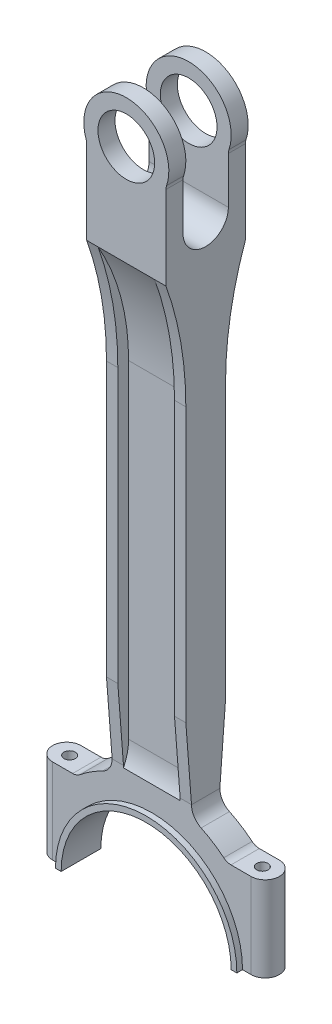
from build123d import *

# Parameters (mm, degrees)
SKETCH1_R               = 5
BOSS_EXTRUDE1_DEPTH     = 14
CUT_EXTRUDE1_DEPTH      = 14
CUT_EXTRUDE1_DEPTH_BACK = 21
CUT_EXTRUDE2_DEPTH      = 26
CUT_EXTRUDE2_DEPTH_BACK = 28
CUT_EXTRUDE3_DEPTH      = 5
CUT_EXTRUDE3_DEPTH_BACK = 5
CUT_EXTRUDE4_START      = -1
CUT_EXTRUDE4_DEPTH      = 1
CUT_EXTRUDE6_START      = -7
CUT_EXTRUDE6_DEPTH      = 1
SKETCH8_R               = 1
CUT_EXTRUDE8_DEPTH      = 15
FILLET2_RADIUS          = 2.5
FILLET2_LENGTH          = 15
FILLET3_RADIUS          = 2.5
FILLET3_LENGTH          = 15
FILLET4_R               = 3
FILLET5_R               = 2
CUT_EXTRUDE9_DEPTH      = 95.601560752
CUT_EXTRUDE9_DEPTH_BACK = 22
CUT_EXTRUDE10_DEPTH     = 19


with BuildPart() as part:
    # Sketch1 → Boss-Extrude1 (new body)
    with BuildSketch(Plane.XY):
        with BuildLine():
            Line((7, 27.728093549), (7, -70.844330052))
            ThreePointArc((7, -70.844330052), (9.983048869, -72.249040285), (12.694763676, -74.124778593))
            ThreePointArc((12.694763676, -74.124778593), (13.290040181, -74.462261791), (13.964240044, -74.579324047))
            Line((13.964240044, -74.579324047), (20, -74.579324047))
            Line((20, -74.579324047), (20, -89.579324047))
            Line((20, -89.579324047), (15, -89.579324047))
            ThreePointArc((15, -89.579324047), (0, -74.579324047), (-15, -89.579324047))
            Line((-15, -89.579324047), (-20, -89.579324047))
            Line((-20, -89.579324047), (-20, -74.579324047))
            Line((-20, -74.579324047), (-13.964240044, -74.579324047))
            ThreePointArc((-13.964240044, -74.579324047), (-13.290040181, -74.462261791), (-12.694763676, -74.124778593))
            ThreePointArc((-12.694763676, -74.124778593), (-9.983048869, -72.249040285), (-7, -70.844330052))
            Line((-7, -70.844330052), (-7, 27.728093549))
            ThreePointArc((-7, 27.728093549), (0, 37.920675953), (7, 27.728093549))
        make_face()
        with Locations((0, 30.420675953)):
            Circle(SKETCH1_R, mode=Mode.SUBTRACT)
    extrude(amount=BOSS_EXTRUDE1_DEPTH)

    # Sketch2 → Cut-Extrude1 (cut, two sides: drawn at the far end of the back side and taken through both)
    with BuildSketch(Plane(origin=(7, 0, 0), x_dir=(0, 0, -1), z_dir=(1, 0, 0)).offset(-CUT_EXTRUDE1_DEPTH_BACK)):
        with BuildLine():
            Line((-11, 19.155669948), (-11, 94.026923789))
            Line((-11, 94.026923789), (-3, 94.026923789))
            Line((-3, 94.026923789), (-3, 19.155669948))
            ThreePointArc((-3, 19.155669948), (-7, 15.155669948), (-11, 19.155669948))
        make_face()
    extrude(amount=CUT_EXTRUDE1_DEPTH + CUT_EXTRUDE1_DEPTH_BACK, mode=Mode.SUBTRACT)

    # Sketch3 → Cut-Extrude2 (cut, two sides: drawn at the far end of the back side and taken through both)
    with BuildSketch(Plane.ZY.offset(7).offset(-CUT_EXTRUDE2_DEPTH_BACK)):
        with BuildLine():
            Line((3.5, -7.579324047), (3.5, -89.579324047))
            Line((3.5, -89.579324047), (0, -89.579324047))
            Line((0, -89.579324047), (0, 12.613496459))
            ThreePointArc((0, 12.613496459), (2.618525015, 2.667626719), (3.5, -7.579324047))
        make_face()
        with BuildLine():
            Line((10.5, -7.579324047), (10.5, -89.579324047))
            Line((10.5, -89.579324047), (14, -89.579324047))
            Line((14, -89.579324047), (14, 12.613496459))
            ThreePointArc((14, 12.613496459), (11.381474985, 2.667626719), (10.5, -7.579324047))
        make_face()
    extrude(amount=CUT_EXTRUDE2_DEPTH + CUT_EXTRUDE2_DEPTH_BACK, mode=Mode.SUBTRACT)

    # Sketch4 → Cut-Extrude3 (cut, two sides: drawn at the far end of the back side and taken through both)
    with BuildSketch(Plane(origin=(0, 0, 0), x_dir=(0, 0, -1), z_dir=(1, 0, 0)).offset(-CUT_EXTRUDE3_DEPTH_BACK)):
        with BuildLine():
            Line((-5.4, -7.457377961), (-5.4, -65.313507329))
            ThreePointArc((-5.4, -65.313507329), (-4.911756575, -68.237545632), (-3.5, -70.844330052))
            Line((-3.5, -70.844330052), (19.637557059, -70.844330052))
            Line((19.637557059, -70.844330052), (19.637557059, 12.613496459))
            Line((19.637557059, 12.613496459), (0, 12.613496459))
            ThreePointArc((0, 12.613496459), (-4.026415832, 2.934926884), (-5.4, -7.457377961))
        make_face()
        with BuildLine():
            Line((-8.6, -7.457377961), (-8.6, -65.313507329))
            ThreePointArc((-8.6, -65.313507329), (-9.088243425, -68.237545632), (-10.5, -70.844330052))
            Line((-10.5, -70.844330052), (-24.530573049, -70.844330052))
            Line((-24.530573049, -70.844330052), (-24.530573049, 12.613496459))
            Line((-24.530573049, 12.613496459), (-14, 12.613496459))
            ThreePointArc((-14, 12.613496459), (-9.973584168, 2.934926884), (-8.6, -7.457377961))
        make_face()
    extrude(amount=CUT_EXTRUDE3_DEPTH + CUT_EXTRUDE3_DEPTH_BACK, mode=Mode.SUBTRACT)

    # Sketch5 → Cut-Extrude4 (cut)
    with BuildSketch(Plane.XY.offset(10.5).offset(CUT_EXTRUDE4_START)):
        with BuildLine():
            Line((-16, -89.579324047), (-20, -89.579324047))
            Line((-20, -89.579324047), (-20, -74.579324047))
            Line((-20, -74.579324047), (-13.964240044, -74.579324047))
            ThreePointArc((-13.964240044, -74.579324047), (-13.290040181, -74.462261791), (-12.694763676, -74.124778593))
            ThreePointArc((-12.694763676, -74.124778593), (0, -69.579324047), (12.694763676, -74.124778593))
            ThreePointArc((12.694763676, -74.124778593), (13.290040181, -74.462261791), (13.964240044, -74.579324047))
            Line((13.964240044, -74.579324047), (20, -74.579324047))
            Line((20, -74.579324047), (20, -89.579324047))
            Line((20, -89.579324047), (16, -89.579324047))
            ThreePointArc((16, -89.579324047), (0, -73.579324047), (-16, -89.579324047))
        make_face()
    extrude(amount=CUT_EXTRUDE4_DEPTH, mode=Mode.SUBTRACT)

    # Sketch5<3> → Cut-Extrude6 (cut)
    with BuildSketch(Plane.XY.offset(10.5).offset(CUT_EXTRUDE6_START)):
        with BuildLine():
            Line((-16, -89.579324047), (-20, -89.579324047))
            Line((-20, -89.579324047), (-20, -74.579324047))
            Line((-20, -74.579324047), (-13.964240044, -74.579324047))
            ThreePointArc((-13.964240044, -74.579324047), (-13.290040181, -74.462261791), (-12.694763676, -74.124778593))
            ThreePointArc((-12.694763676, -74.124778593), (0, -69.579324047), (12.694763676, -74.124778593))
            ThreePointArc((12.694763676, -74.124778593), (13.290040181, -74.462261791), (13.964240044, -74.579324047))
            Line((13.964240044, -74.579324047), (20, -74.579324047))
            Line((20, -74.579324047), (20, -89.579324047))
            Line((20, -89.579324047), (16, -89.579324047))
            ThreePointArc((16, -89.579324047), (0, -73.579324047), (-16, -89.579324047))
        make_face()
    extrude(amount=CUT_EXTRUDE6_DEPTH, mode=Mode.SUBTRACT)

    # Sketch8 → Cut-Extrude8 (cut)
    with BuildSketch(Plane(origin=(0, -74.579324047, 0), x_dir=(1, 0, 0), z_dir=(0, 1, 0))):
        with Locations(Location((17, -7, 0), (0, 0, 270))):
            Circle(SKETCH8_R)
        with Locations(Location((-17, -7, 0), (0, 0, 270))):
            Circle(SKETCH8_R)
    extrude(amount=-CUT_EXTRUDE8_DEPTH, mode=Mode.SUBTRACT)

    # Fillet2: full round fillet: the end face becomes a half cylinder, R = half its width
    fillet2_face = Plane((-20, -82.079324047, 7), x_dir=(0, 1, 0), z_dir=(-1, 0, 0))  # on the end face: x along it, z out of the body
    fillet2_slab = fillet2_face.offset(-FILLET2_RADIUS / 2) * Box(FILLET2_LENGTH, 2 * FILLET2_RADIUS, FILLET2_RADIUS, mode=Mode.PRIVATE)  # the body's end, R deep
    fillet2_round = Plane((-17.5, -82.079324047, 7), x_dir=(-1, 0, 0), z_dir=(0, 1, 0)) * Cylinder(FILLET2_RADIUS, FILLET2_LENGTH, mode=Mode.PRIVATE)  # its axis R under the face
    add(fillet2_slab - fillet2_round, mode=Mode.SUBTRACT)

    # Fillet3: full round fillet: the end face becomes a half cylinder, R = half its width
    fillet3_face = Plane((20, -82.079324047, 7), x_dir=(0, -1, 0), z_dir=(1, 0, 0))  # on the end face: x along it, z out of the body
    fillet3_slab = fillet3_face.offset(-FILLET3_RADIUS / 2) * Box(FILLET3_LENGTH, 2 * FILLET3_RADIUS, FILLET3_RADIUS, mode=Mode.PRIVATE)  # the body's end, R deep
    fillet3_round = Plane((17.5, -82.079324047, 7), x_dir=(1, 0, 0), z_dir=(0, -1, 0)) * Cylinder(FILLET3_RADIUS, FILLET3_LENGTH, mode=Mode.PRIVATE)  # its axis R under the face
    add(fillet3_slab - fillet3_round, mode=Mode.SUBTRACT)

    # Fillet4
    fillet4_edges = [part.edges().sort_by_distance(p)[0] for p in [
        (-7, -70.844330052, 7),
        (7, -70.844330052, 7),
    ]]
    fillet(fillet4_edges, radius=FILLET4_R)

    # Fillet5
    fillet5_edges = [part.edges().sort_by_distance(p)[0] for p in [
        (-7, 27.728093549, 12.5),
        (7, 27.728093549, 12.5),
        (-7, 27.728093549, 1.5),
        (7, 27.728093549, 1.5),
    ]]
    fillet(fillet5_edges, radius=FILLET5_R)

    # Sketch10 → Cut-Extrude9 (cut, two sides: drawn at the far end of the back side and taken through both)
    with BuildSketch(Plane(origin=(7, 0, 0), x_dir=(0, 0, -1), z_dir=(1, 0, 0)).offset(-CUT_EXTRUDE9_DEPTH_BACK)):
        Polygon((-3.5, -55.844330052), (-4.5, -68.86700887), (-4.5, -70.844330052), (-3.5, -70.844330052), align=None)
    extrude(amount=CUT_EXTRUDE9_DEPTH + CUT_EXTRUDE9_DEPTH_BACK, mode=Mode.SUBTRACT)

    # Sketch11 → Cut-Extrude10 (cut)
    with BuildSketch(Plane(origin=(7, 0, 0), x_dir=(0, 0, -1), z_dir=(1, 0, 0))):
        Polygon((-9.5, -70.844330052), (-10.5, -70.844330052), (-10.5, -55.844330052), (-9.5, -68.86700887), align=None)
    extrude(amount=-CUT_EXTRUDE10_DEPTH, mode=Mode.SUBTRACT)


solid = part.part
